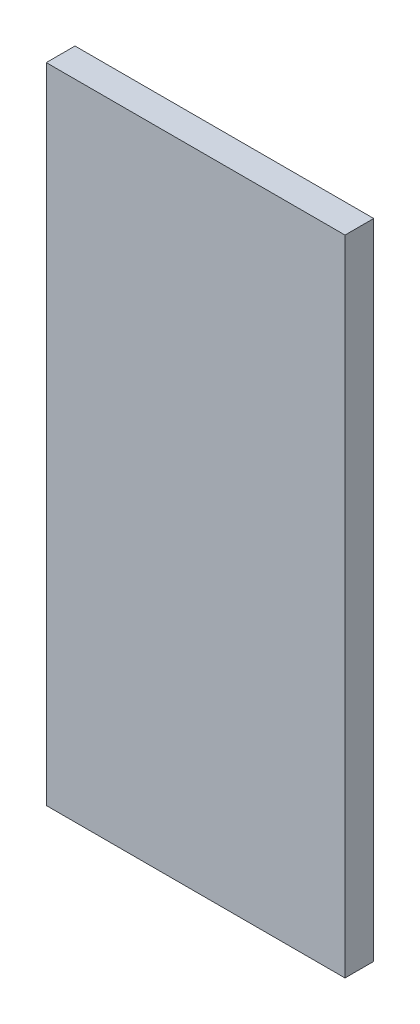
from build123d import *

# Parameters (mm, degrees)
SKETCH1_W           = 66.04
SKETCH1_H           = 142.24
BOSS_EXTRUDE1_DEPTH = 6.35


with BuildPart() as part:
    # Sketch1 → Boss-Extrude1 (new body)
    with BuildSketch(Plane.XY):
        Rectangle(SKETCH1_W, SKETCH1_H)
    extrude(amount=BOSS_EXTRUDE1_DEPTH)


solid = part.part
